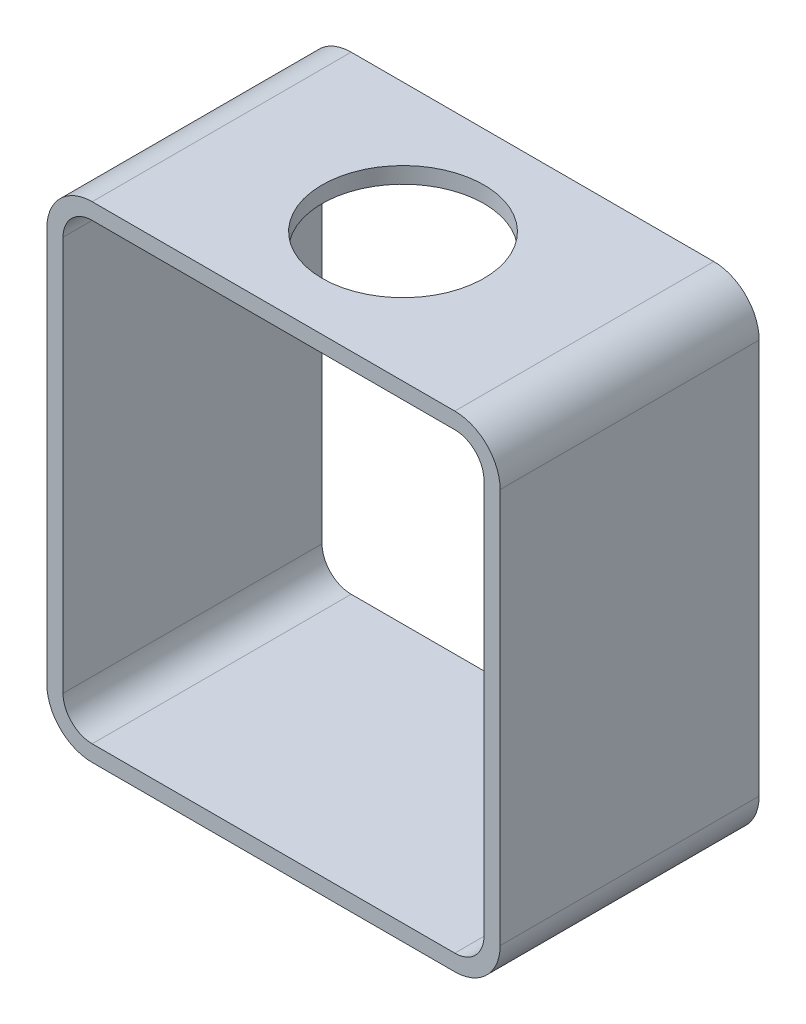
from build123d import *

# Parameters (mm, degrees)
SKETCH_1_W          = 28
SKETCH_1_H          = 30
SKETCH_1_W_2        = 26
SKETCH_1_H_2        = 28
EXTRUDE_1_DEPTH     = 16
FILLET_1_R          = 1.8
FILLET_2_R          = 2.8
SKETCH_2_R          = 5
CUT_EXTRUDE_1_DEPTH = 16


with BuildPart() as part:
    # Эскиз1 → Бобышка-Вытянуть1 (new body)
    with BuildSketch(Plane.XY):
        with Locations((14, 15)):
            Rectangle(SKETCH_1_W, SKETCH_1_H)
        with Locations((14, 15)):
            Rectangle(SKETCH_1_W_2, SKETCH_1_H_2, mode=Mode.SUBTRACT)
    extrude(amount=EXTRUDE_1_DEPTH)

    # Скругление1
    fillet_1_edges = [part.edges().sort_by_distance(p)[0] for p in [
        (27, 29, 8),
        (1, 29, 8),
        (1, 1, 8),
        (27, 1, 8),
    ]]
    fillet(fillet_1_edges, radius=FILLET_1_R)

    # Скругление2
    fillet_2_edges = [part.edges().sort_by_distance(p)[0] for p in [
        (0, 30, 8),
        (28, 30, 8),
        (28, 0, 8),
        (0, 0, 8),
    ]]
    fillet(fillet_2_edges, radius=FILLET_2_R)

    # Эскиз2 → Вырез-Вытянуть1 (cut)
    with BuildSketch(Plane(origin=(0, 30, 0), x_dir=(1, 0, 0), z_dir=(0, 1, 0))):
        with Locations(Location((14, -8, 0), (0, 0, 270))):
            Circle(SKETCH_2_R)
    extrude(amount=-CUT_EXTRUDE_1_DEPTH, mode=Mode.SUBTRACT)


solid = part.part
